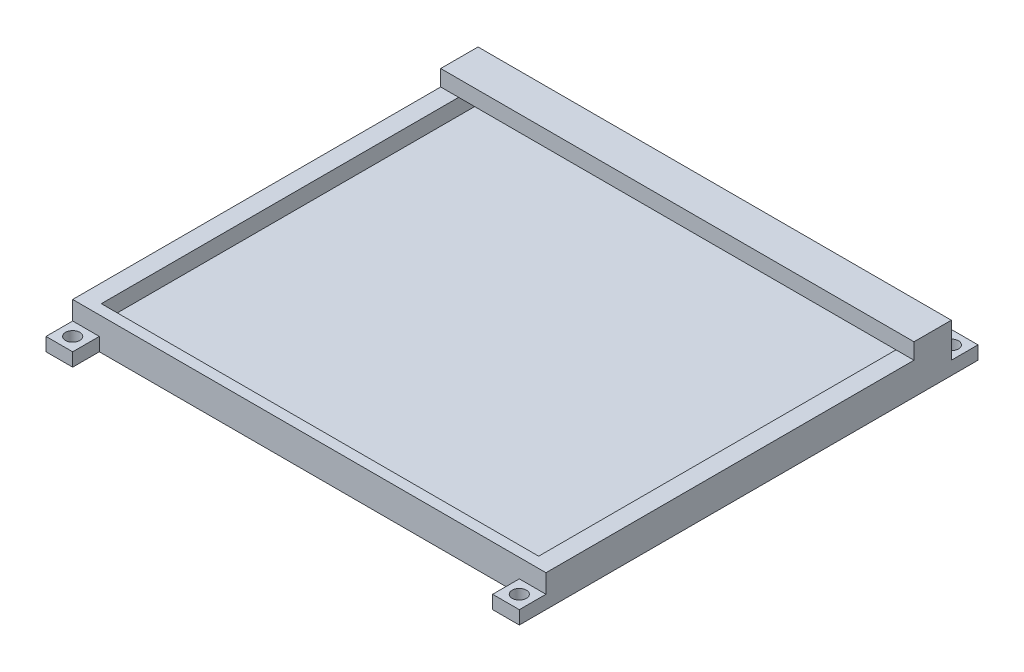
from build123d import *

# Parameters (mm, degrees)
SKETCH1_W           = 112.699999898
SKETCH1_H           = 96.52
BOSS_EXTRUDE1_DEPTH = 7.62
SKETCH2_W           = 104.14
SKETCH2_H           = 91.44
CUT_EXTRUDE1_DEPTH  = 3.81
SKETCH3_W           = 6.35
SKETCH3_H           = 6.35
SKETCH3_R           = 1.7
BOSS_EXTRUDE2_DEPTH = 3.175
SKETCH4_W           = 112.699999898
SKETCH4_H           = 8.89
BOSS_EXTRUDE3_DEPTH = 3.81


with BuildPart() as part:
    # Sketch1 → Boss-Extrude1 (new body)
    with BuildSketch(Plane(origin=(0, 0, 0), x_dir=(1, 0, 0), z_dir=(0, 1, 0))):
        with Locations((56.349999949, 48.26)):
            Rectangle(SKETCH1_W, SKETCH1_H)
    extrude(amount=BOSS_EXTRUDE1_DEPTH)

    # Sketch2 → Cut-Extrude1 (cut)
    with BuildSketch(Plane(origin=(0, 7.62, 0), x_dir=(1, 0, 0), z_dir=(0, 1, 0))):
        with Locations((56.349999949, 48.26)):
            Rectangle(SKETCH2_W, SKETCH2_H)
    extrude(amount=-CUT_EXTRUDE1_DEPTH, mode=Mode.SUBTRACT)

    # Sketch3 → Boss-Extrude2 (add)
    # profile 1 of 4: a face of its own
    with BuildSketch(Plane.XZ):
        with Locations((109.524999898, 3.175)):
            Rectangle(SKETCH3_W, SKETCH3_H)
        with Locations(Location((109.524999898, 3.175, 0), (0, 0, 270))):
            Circle(SKETCH3_R, mode=Mode.SUBTRACT)
    # profile 2 of 4: a face of its own
    with BuildSketch(Plane.XZ):
        with Locations((3.175, 3.175)):
            Rectangle(SKETCH3_W, SKETCH3_H)
        with Locations(Location((3.175, 3.175, 0), (0, 0, 270))):
            Circle(SKETCH3_R, mode=Mode.SUBTRACT)
    # profile 3 of 4: a face of its own
    with BuildSketch(Plane.XZ):
        with Locations((3.175, -99.695)):
            Rectangle(SKETCH3_W, SKETCH3_H)
        with Locations(Location((3.175, -99.695, 0), (0, 0, 270))):
            Circle(SKETCH3_R, mode=Mode.SUBTRACT)
    # profile 4 of 4: a face of its own
    with BuildSketch(Plane.XZ):
        with Locations((109.524999898, -99.695)):
            Rectangle(SKETCH3_W, SKETCH3_H)
        with Locations(Location((109.524999898, -99.695, 0), (0, 0, 270))):
            Circle(SKETCH3_R, mode=Mode.SUBTRACT)
    extrude(amount=-BOSS_EXTRUDE2_DEPTH)

    # Sketch4 → Boss-Extrude3 (add)
    with BuildSketch(Plane(origin=(0, 7.62, 0), x_dir=(1, 0, 0), z_dir=(0, 1, 0))):
        with Locations((56.349999949, 92.075)):
            Rectangle(SKETCH4_W, SKETCH4_H)
    extrude(amount=BOSS_EXTRUDE3_DEPTH)


solid = part.part
